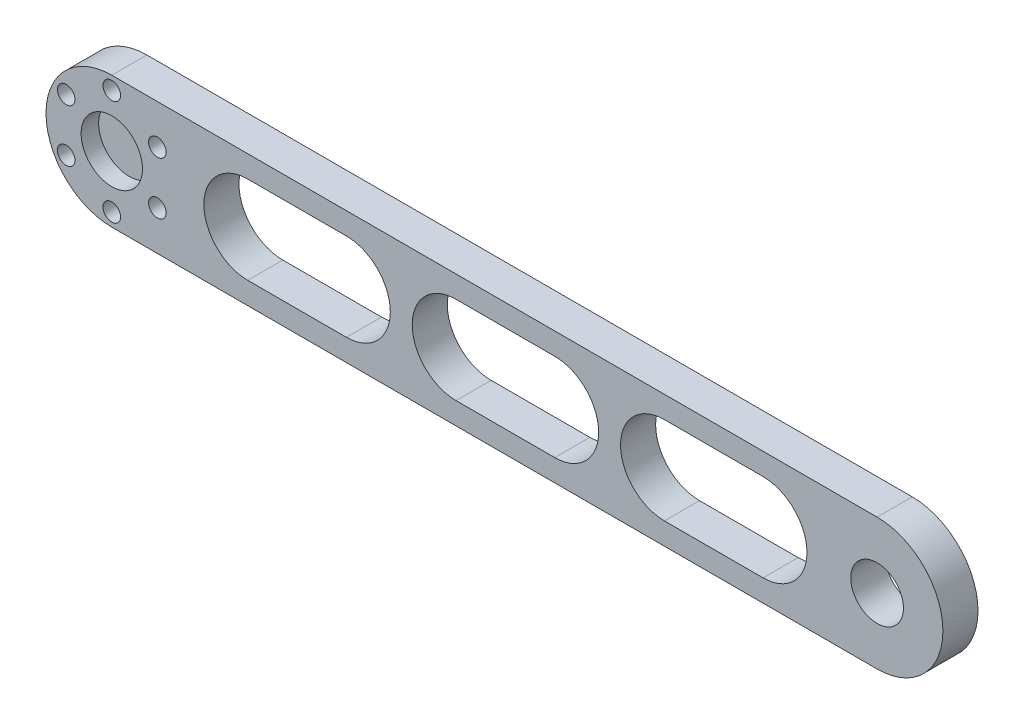
from build123d import *

# Parameters (mm, degrees)
SKETCH1_R           = 6
BOSS_EXTRUDE1_DEPTH = 8
CIRPATTERN1_COUNT   = 6
SKETCH9_R           = 7
CUT_EXTRUDE1_DEPTH  = 4


with BuildPart() as part:
    # Sketch1 → Boss-Extrude1 (new body)
    with BuildSketch(Plane.XY):
        with BuildLine():
            Line((-87.25, 15), (87.25, 15))
            ThreePointArc((87.25, 15), (102.25, 0), (87.25, -15))
            Line((87.25, -15), (-87.25, -15))
            ThreePointArc((-87.25, -15), (-102.25, 0), (-87.25, 15))
        make_face()
        with Locations((87.25, 0)):
            Circle(SKETCH1_R, mode=Mode.SUBTRACT)
        with BuildLine():
            Line((61.25, -10), (38.75, -10))
            ThreePointArc((38.75, -10), (28.75, 0), (38.75, 10))
            Line((38.75, 10), (61.25, 10))
            ThreePointArc((61.25, 10), (71.25, 0), (61.25, -10))
        make_face(mode=Mode.SUBTRACT)
        with BuildLine():
            Line((13.75, -10), (-8.75, -10))
            ThreePointArc((-8.75, -10), (-18.75, 0), (-8.75, 10))
            Line((-8.75, 10), (13.75, 10))
            ThreePointArc((13.75, 10), (23.75, 0), (13.75, -10))
        make_face(mode=Mode.SUBTRACT)
        with BuildLine():
            Line((-33.75, -10), (-56.25, -10))
            ThreePointArc((-56.25, -10), (-66.25, 0), (-56.25, 10))
            Line((-56.25, 10), (-33.75, 10))
            ThreePointArc((-33.75, 10), (-23.75, 0), (-33.75, -10))
        make_face(mode=Mode.SUBTRACT)
    extrude(amount=BOSS_EXTRUDE1_DEPTH)

    # Sketch7 → Ø4.0mm Dowel Hole1 (revolve, cut)
    with BuildSketch(Plane(origin=(-87.25, 12, 0), x_dir=(0, 1, 0), z_dir=(1, 0, 0))):
        Polygon((0, 0), (0, 101.201721238), (2, 100), (2, 0), align=None)
    f_4_0mm_dowel_hole1 = revolve(axis=Axis((-87.25, 12, -6.35), (0, 0, 1)), mode=Mode.SUBTRACT)

    # CirPattern1: Ø4.0mm Dowel Hole1 ×6 about axis
    cirpattern1_axis = Axis((-87.25, 0, 38), (0, 0, -1))
    for i in range(1, CIRPATTERN1_COUNT):
        add(f_4_0mm_dowel_hole1.rotate(cirpattern1_axis, i * 360 / CIRPATTERN1_COUNT), mode=Mode.SUBTRACT)

    # Sketch9 → Cut-Extrude1 (cut)
    with BuildSketch(Plane.XY.offset(8)):
        with Locations((-87.25, 0)):
            Circle(SKETCH9_R)
    extrude(amount=-CUT_EXTRUDE1_DEPTH, mode=Mode.SUBTRACT)


solid = part.part
